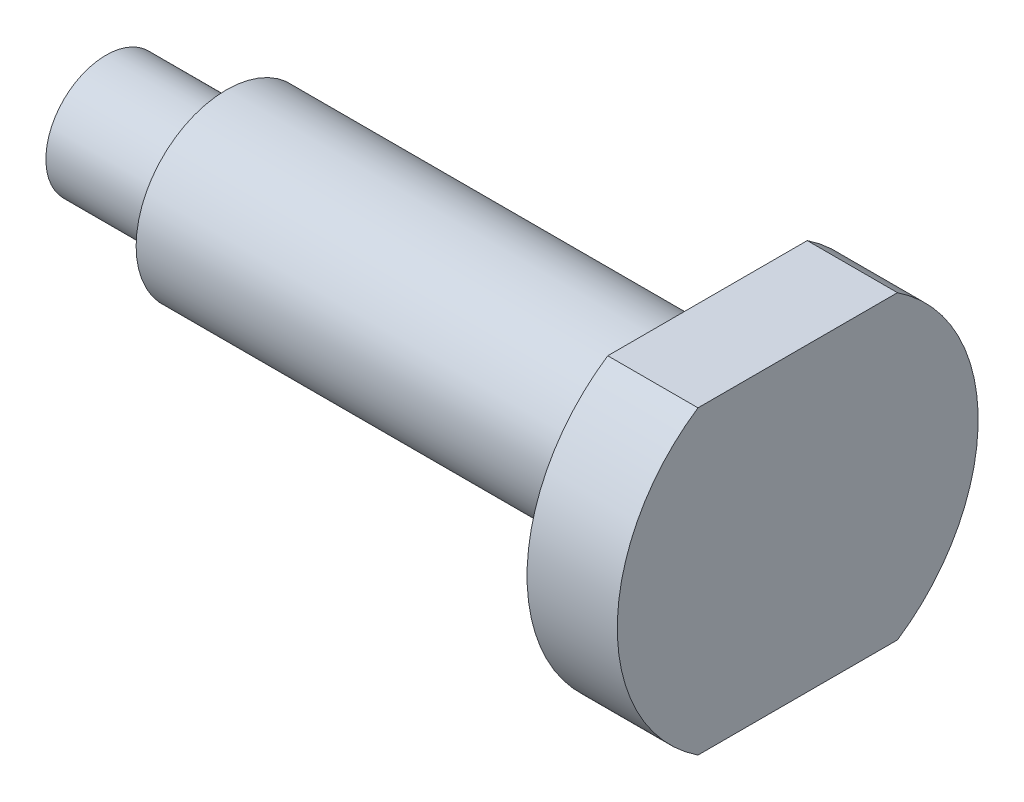
from build123d import *

# Parameters (mm, degrees)
BOSS_EXTRUDE1_DEPTH = 3
BOSS_EXTRUDE2_DEPTH = 16
BOSS_EXTRUDE3_DEPTH = 20


with BuildPart() as part:
    # Sketch2 → Boss-Extrude1 (new body)
    with BuildSketch(Plane(origin=(0, 0, 0), x_dir=(0, 0, -1), z_dir=(1, 0, 0))):
        with BuildLine():
            Line((3.31662479, 5), (-3.31662479, 5))
            ThreePointArc((-3.31662479, 5), (-5.286764074, 2.837274331), (-6, 0))
            ThreePointArc((-6, 0), (-5.286764074, -2.837274331), (-3.31662479, -5))
            Line((-3.31662479, -5), (3.31662479, -5))
            ThreePointArc((3.31662479, -5), (6, 0), (3.31662479, 5))
        make_face()
    extrude(amount=BOSS_EXTRUDE1_DEPTH)

    # Sketch2<4> → Boss-Extrude2 (add)
    with BuildSketch(Plane(origin=(0, 0, 0), x_dir=(0, 0, -1), z_dir=(1, 0, 0))):
        with BuildLine():
            ThreePointArc((3, 0), (0, 3), (-3, 0))
            ThreePointArc((-3, 0), (0, -3), (3, 0))
        make_face()
        with BuildLine():
            ThreePointArc((2, 0), (0, -2), (-2, 0))
            ThreePointArc((-2, 0), (0, 2), (2, 0))
        make_face(mode=Mode.SUBTRACT)
    extrude(amount=-BOSS_EXTRUDE2_DEPTH)

    # Sketch2<5> → Boss-Extrude3 (add)
    with BuildSketch(Plane(origin=(0, 0, 0), x_dir=(0, 0, -1), z_dir=(1, 0, 0))):
        with BuildLine():
            ThreePointArc((2, 0), (0, 2), (-2, 0))
            ThreePointArc((-2, 0), (0, -2), (2, 0))
        make_face()
    extrude(amount=-BOSS_EXTRUDE3_DEPTH)


solid = part.part
